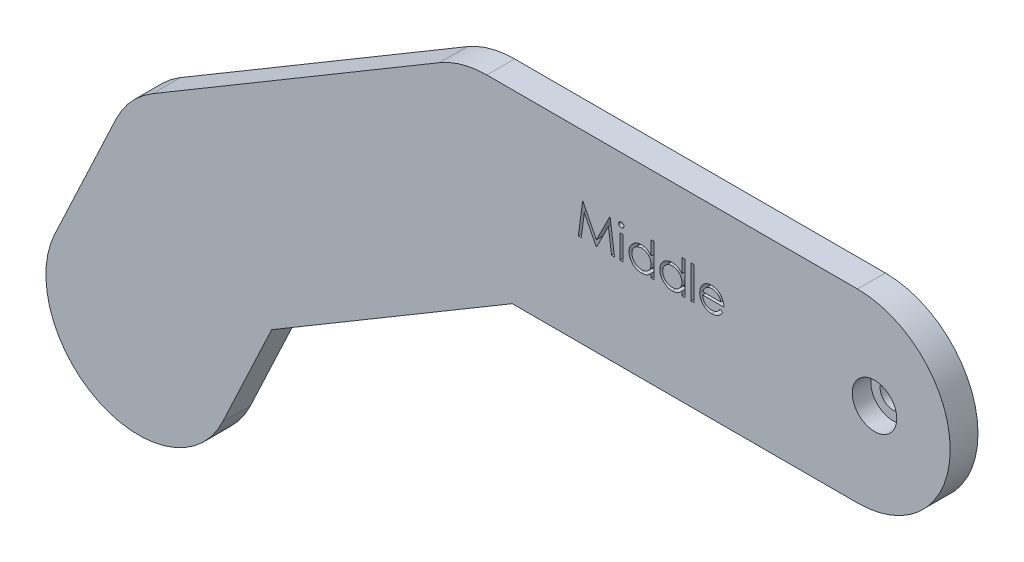
from build123d import *

# Parameters (mm, degrees)
BOSS_EXTRUDE1_DEPTH = 3
BOSS_EXTRUDE2_DEPTH = 3
BOSS_EXTRUDE4_DEPTH = 3
SKETCH4_R           = 1.4
CUT_EXTRUDE5_DEPTH  = 3
SKETCH5_R           = 2.4
CUT_EXTRUDE6_DEPTH  = 2
SKETCH7_W           = 0.314102564
SKETCH7_H           = 2.557692308
SKETCH7_H_2         = 3.58974359
CUT_EXTRUDE7_DEPTH  = 1


with BuildPart() as part:
    # Sketch1 → Boss-Extrude1 (new body)
    with BuildSketch(Plane.XY):
        with BuildLine():
            Line((0, 10), (40, 10))
            ThreePointArc((40, 10), (50, 0), (40, -10))
            Line((40, -10), (0, -10))
            ThreePointArc((0, -10), (-10, 0), (0, 10))
        make_face()
    extrude(amount=BOSS_EXTRUDE1_DEPTH)

    # Sketch2 → Boss-Extrude2 (add)
    with BuildSketch(Plane.XY):
        with BuildLine():
            Line((5.104260767, -8.599216361), (-25.852918132, -26.974555123))
            ThreePointArc((-25.852918132, -26.974555123), (-39.55639526, -23.479599529), (-36.061439666, -9.776122401))
            Line((-36.061439666, -9.776122401), (-5.104260767, 8.599216361))
            ThreePointArc((-5.104260767, 8.599216361), (8.599216361, 5.104260767), (5.104260767, -8.599216361))
        make_face()
    extrude(amount=BOSS_EXTRUDE2_DEPTH)

    # Sketch3 → Boss-Extrude4 (add)
    with BuildSketch(Plane.XY):
        with BuildLine():
            Line((-21.908567374, -22.63240694), (-28.526578438, -36.699320758))
            ThreePointArc((-28.526578438, -36.699320758), (-41.832258141, -41.490864104), (-46.623801487, -28.185184401))
            Line((-46.623801487, -28.185184401), (-40.005790424, -14.118270584))
            ThreePointArc((-40.005790424, -14.118270584), (-26.700110721, -9.326727237), (-21.908567374, -22.63240694))
        make_face()
    extrude(amount=BOSS_EXTRUDE4_DEPTH)

    # Sketch4 → Cut-Extrude5 (cut)
    with BuildSketch(Plane.XY):
        with Locations((41.835442891, 0)):
            Circle(SKETCH4_R)
    extrude(amount=CUT_EXTRUDE5_DEPTH, mode=Mode.SUBTRACT)

    # Sketch5 → Cut-Extrude6 (cut)
    with BuildSketch(Plane.XY.offset(3)):
        with Locations((41.835442891, 0)):
            Circle(SKETCH5_R)
    extrude(amount=-CUT_EXTRUDE6_DEPTH, mode=Mode.SUBTRACT)

    # Sketch7 → Cut-Extrude7 (cut)
    # profile 1 of 7: a face of its own
    with BuildSketch(Plane.XY.offset(3)):
        Polygon((9.870736081, -0.120306472), (10.332775344, 3.379693528), (10.377647139, 3.379693528), (11.822659158, 0.507898656), (13.264165569, 3.379693528), (13.309738485, 3.379693528), (13.774582235, -0.120306472), (13.459077428, -0.120306472), (13.12394121, 2.398123015), (11.860519735, -0.120306472), (11.789706434, -0.120306472), (10.521377107, 2.40373199), (10.186942011, -0.120306472), align=None)
    # profile 2 of 7: a face of its own
    with BuildSketch(Plane.XY.offset(3)):
        with BuildLine():
            add(Edge.make_bspline(
                [(14.513564607, 3.514308913), (14.533055923, 3.51340476), (14.571223663, 3.511634256), (14.62641693, 3.496472779), (14.676673942, 3.470773094), (14.721251675, 3.436293413), (14.759503562, 3.395743969), (14.786284272, 3.348483001), (14.803496668, 3.297424362), (14.805575224, 3.261809273), (14.806633517, 3.2436759)],
                knots=[0, 0, 0, 0, 1.055194115, 2.066272739, 3.074728998, 4.095836921, 5.109056067, 6.073838105, 7.019297344, 8, 8, 8, 8], degree=3))
            add(Edge.make_bspline(
                [(14.806633517, 3.2436759), (14.805551357, 3.226013247), (14.803412056, 3.191096272), (14.786297567, 3.1409228), (14.759275329, 3.094318516), (14.721276204, 3.053847806), (14.676667443, 3.019387186), (14.626418657, 2.993682447), (14.571223208, 2.97852231), (14.533055769, 2.976751621), (14.513564607, 2.975847374)],
                knots=[0, 0, 0, 0, 0.96129708, 1.900370562, 2.859976407, 3.87933698, 4.906634145, 5.921202961, 6.938410037, 8, 8, 8, 8], degree=3))
            add(Edge.make_bspline(
                [(14.513564607, 2.975847374), (14.494296332, 2.976717094), (14.456793152, 2.978409891), (14.402426309, 2.993979909), (14.35259782, 3.019395982), (14.307933147, 3.053622167), (14.270702954, 3.094567064), (14.243604629, 3.140894358), (14.226529667, 3.191103513), (14.224385038, 3.226015679), (14.223300184, 3.2436759)],
                knots=[0, 0, 0, 0, 1.054934014, 2.053291228, 3.073705704, 4.106921865, 5.123545215, 6.088680038, 7.033164197, 8, 8, 8, 8], degree=3))
            add(Edge.make_bspline(
                [(14.223300184, 3.2436759), (14.224361271, 3.26180675), (14.226445312, 3.297416882), (14.243617428, 3.348511915), (14.270477236, 3.395493417), (14.307957799, 3.436518916), (14.352591259, 3.470764351), (14.402428005, 3.496175333), (14.456792704, 3.511746672), (14.49429618, 3.513439286), (14.513564607, 3.514308913)],
                knots=[0, 0, 0, 0, 0.98631895, 1.937192651, 2.907499808, 3.917963147, 4.944918757, 5.95915025, 6.951458133, 8, 8, 8, 8], degree=3))
        make_face()
    # profile 3 of 7: a face of its own
    with BuildSketch(Plane.XY.offset(3)):
        with Locations((14.514966851, 1.158539682)):
            Rectangle(SKETCH7_W, SKETCH7_H)
    # profile 4 of 7: a face of its own
    with BuildSketch(Plane.XY.offset(3)):
        with BuildLine():
            Line((18.037402748, 3.469437118), (18.037402748, -0.120306472))
            Line((18.037402748, -0.120306472), (17.723300184, -0.120306472))
            Line((17.723300184, -0.120306472), (17.723300184, 0.322101381))
            add(Edge.make_bspline(
                [(17.723300184, 0.322101381), (17.687881393, 0.282061787), (17.618761178, 0.203924016), (17.50332006, 0.101841843), (17.380951882, 0.017463522), (17.252250561, -0.050686394), (17.117332318, -0.10187845), (16.97649623, -0.13826461), (16.82968485, -0.161658445), (16.729432495, -0.163994467), (16.67862871, -0.165178267)],
                knots=[0, 0, 0, 0, 1.074387032, 2.096679803, 3.090159297, 4.057316773, 5.018401886, 5.985159533, 6.978961417, 8, 8, 8, 8], degree=3))
            add(Edge.make_bspline(
                [(16.67862871, -0.165178267), (16.633460756, -0.163951894), (16.544387551, -0.161533434), (16.413358474, -0.14277113), (16.287266224, -0.112640509), (16.165991652, -0.070739619), (16.050319506, -0.015158798), (15.93925941, 0.05138245), (15.833386717, 0.13062328), (15.734315179, 0.221211309), (15.643083178, 0.319606296), (15.563021906, 0.424551843), (15.496268826, 0.535594147), (15.440448745, 0.651327301), (15.397452401, 0.77264222), (15.367478766, 0.899119388), (15.34873832, 1.030609262), (15.346320859, 1.120148785), (15.345095056, 1.1655509)],
                knots=[0, 0, 0, 0, 1.033919861, 2.038935746, 3.024066025, 3.998881131, 4.97069526, 5.957263378, 6.95902576, 7.993208707, 9.027059324, 10.027763471, 11.009749337, 11.988697705, 12.965288445, 13.950418724, 14.960734635, 16, 16, 16, 16], degree=3))
            add(Edge.make_bspline(
                [(15.345095056, 1.1655509), (15.346348027, 1.210014603), (15.348825084, 1.297916947), (15.367278304, 1.427195645), (15.398309312, 1.551713906), (15.44185716, 1.671070849), (15.497699115, 1.785410899), (15.565627202, 1.894814924), (15.645646327, 1.999584321), (15.737898734, 2.097255548), (15.837833504, 2.187476162), (15.944742235, 2.265885208), (16.055965516, 2.333602057), (16.173228527, 2.387255533), (16.294795632, 2.430664638), (16.421749077, 2.460697606), (16.553560656, 2.478394927), (16.643051148, 2.480957691), (16.688444415, 2.482257631)],
                knots=[0, 0, 0, 0, 1.020392517, 2.01726096, 2.990465484, 3.961182959, 4.928053699, 5.906110375, 6.912531644, 7.948652711, 8.985773172, 9.998621852, 10.987621588, 11.969261332, 12.953316658, 13.946091881, 14.958173133, 16, 16, 16, 16], degree=3))
            add(Edge.make_bspline(
                [(16.688444415, 2.482257631), (16.740661222, 2.480690535), (16.843157013, 2.477614499), (16.993055535, 2.451908132), (17.134843145, 2.408745254), (17.269336133, 2.349653973), (17.395732693, 2.272853222), (17.514959333, 2.180101774), (17.624942656, 2.068774628), (17.690014479, 1.985163054), (17.723300184, 1.942393849)],
                knots=[0, 0, 0, 0, 1.031072012, 2.023879775, 2.993683497, 3.952812103, 4.918022106, 5.908088563, 6.929940113, 8, 8, 8, 8], degree=3))
            Line((17.723300184, 1.942393849), (17.723300184, 3.469437118))
            Line((17.723300184, 3.469437118), (18.037402748, 3.469437118))
        make_face()
        with BuildLine():
            add(Edge.make_bspline(
                [(16.692651145, 2.168155067), (16.646736808, 2.166521429), (16.556109208, 2.163296888), (16.423065206, 2.138123393), (16.295751791, 2.096238798), (16.174805717, 2.038956897), (16.062137501, 1.96692816), (15.96144383, 1.879806777), (15.871901128, 1.779969763), (15.796592864, 1.667867653), (15.735202367, 1.547689562), (15.692035335, 1.422065123), (15.663566088, 1.293260146), (15.660657567, 1.20589746), (15.65919762, 1.162045291)],
                knots=[0, 0, 0, 0, 1.031046209, 2.035121221, 3.029706178, 4.034933723, 5.034054252, 6.02443088, 7.017295772, 8.038157696, 9.050218397, 10.03989886, 11.016116709, 12, 12, 12, 12], degree=3))
            add(Edge.make_bspline(
                [(15.65919762, 1.162045291), (15.661062513, 1.118455184), (15.66478499, 1.031445828), (15.691535684, 0.902465251), (15.736415558, 0.776811209), (15.797657621, 0.655550216), (15.874344245, 0.542966115), (15.963232898, 0.441225993), (16.065183179, 0.353736404), (16.178110686, 0.280498831), (16.298718657, 0.22133631), (16.425552588, 0.18017067), (16.556228226, 0.15359289), (16.64508056, 0.150488413), (16.689846658, 0.148924297)],
                knots=[0, 0, 0, 0, 0.979072187, 1.954306742, 2.945804271, 3.96968567, 4.997920485, 5.998718438, 6.996577872, 8.005894225, 9.015743152, 10.005417472, 10.995077863, 12, 12, 12, 12], degree=3))
            add(Edge.make_bspline(
                [(16.689846658, 0.148924297), (16.735293161, 0.150584261), (16.825681748, 0.153885765), (16.959120455, 0.17916703), (17.088615418, 0.220935829), (17.212402647, 0.278834955), (17.327718778, 0.350592311), (17.431216655, 0.434599402), (17.518732624, 0.532302586), (17.592925233, 0.639679039), (17.65110065, 0.757391036), (17.693476709, 0.882725227), (17.718530615, 1.015685975), (17.721688345, 1.106549902), (17.723300184, 1.152930708)],
                knots=[0, 0, 0, 0, 1.01762866, 2.023962475, 3.030623092, 4.058876274, 5.077231937, 6.066672613, 7.034107872, 8.005628644, 8.981990164, 9.965428785, 10.961468474, 12, 12, 12, 12], degree=3))
            add(Edge.make_bspline(
                [(17.723300184, 1.152930708), (17.722340528, 1.188268538), (17.72045162, 1.257824571), (17.706021051, 1.359952089), (17.683066124, 1.457685815), (17.650719954, 1.551128504), (17.60822867, 1.63976352), (17.556980904, 1.72422728), (17.496075454, 1.804080491), (17.426492758, 1.878223562), (17.350327556, 1.945850024), (17.269733015, 2.006214265), (17.183754268, 2.055803038), (17.093837231, 2.096844309), (16.999825897, 2.129503459), (16.900955277, 2.151291153), (16.79827629, 2.166251474), (16.728230234, 2.167513855), (16.692651145, 2.168155067)],
                knots=[0, 0, 0, 0, 1.050140795, 2.067009409, 3.05949893, 4.030605086, 5.00011959, 5.97591094, 6.962425594, 7.979863591, 8.993523472, 9.986985069, 10.967611495, 11.937549037, 12.921786183, 13.919465291, 14.943216303, 16, 16, 16, 16], degree=3))
        make_face(mode=Mode.SUBTRACT)
    # profile 5 of 7: a face of its own
    with BuildSketch(Plane.XY.offset(3)):
        with BuildLine():
            Line((21.357915569, 3.469437118), (21.357915569, -0.120306472))
            Line((21.357915569, -0.120306472), (21.043813004, -0.120306472))
            Line((21.043813004, -0.120306472), (21.043813004, 0.322101381))
            add(Edge.make_bspline(
                [(21.043813004, 0.322101381), (21.008394214, 0.282061787), (20.939273999, 0.203924016), (20.823832881, 0.101841843), (20.701464703, 0.017463522), (20.572763382, -0.050686394), (20.437845138, -0.10187845), (20.297009051, -0.13826461), (20.15019767, -0.161658445), (20.049945315, -0.163994467), (19.99914153, -0.165178267)],
                knots=[0, 0, 0, 0, 1.074387032, 2.096679803, 3.090159297, 4.057316773, 5.018401886, 5.985159533, 6.978961417, 8, 8, 8, 8], degree=3))
            add(Edge.make_bspline(
                [(19.99914153, -0.165178267), (19.953973576, -0.163951894), (19.864900371, -0.161533434), (19.733871294, -0.14277113), (19.607779045, -0.112640509), (19.486504472, -0.070739619), (19.370832327, -0.015158798), (19.25977223, 0.05138245), (19.153899538, 0.13062328), (19.054827999, 0.221211309), (18.963595999, 0.319606296), (18.883534726, 0.424551843), (18.816781646, 0.535594147), (18.760961565, 0.651327301), (18.717965221, 0.77264222), (18.687991587, 0.899119388), (18.66925114, 1.030609262), (18.666833679, 1.120148785), (18.665607876, 1.1655509)],
                knots=[0, 0, 0, 0, 1.033919861, 2.038935746, 3.024066025, 3.998881131, 4.97069526, 5.957263378, 6.95902576, 7.993208707, 9.027059324, 10.027763471, 11.009749337, 11.988697705, 12.965288445, 13.950418724, 14.960734635, 16, 16, 16, 16], degree=3))
            add(Edge.make_bspline(
                [(18.665607876, 1.1655509), (18.666860848, 1.210014603), (18.669337904, 1.297916947), (18.687791124, 1.427195645), (18.718822133, 1.551713906), (18.762369981, 1.671070849), (18.818211936, 1.785410899), (18.886140023, 1.894814924), (18.966159147, 1.999584321), (19.058411554, 2.097255548), (19.158346325, 2.187476162), (19.265255055, 2.265885208), (19.376478337, 2.333602057), (19.493741347, 2.387255533), (19.615308452, 2.430664638), (19.742261898, 2.460697606), (19.874073477, 2.478394927), (19.963563969, 2.480957691), (20.008957235, 2.482257631)],
                knots=[0, 0, 0, 0, 1.020392517, 2.01726096, 2.990465484, 3.961182959, 4.928053699, 5.906110375, 6.912531644, 7.948652711, 8.985773172, 9.998621852, 10.987621588, 11.969261332, 12.953316658, 13.946091881, 14.958173133, 16, 16, 16, 16], degree=3))
            add(Edge.make_bspline(
                [(20.008957235, 2.482257631), (20.061174043, 2.480690535), (20.163669834, 2.477614499), (20.313568355, 2.451908132), (20.455355966, 2.408745254), (20.589848953, 2.349653973), (20.716245513, 2.272853222), (20.835472154, 2.180101774), (20.945455477, 2.068774628), (21.010527299, 1.985163054), (21.043813004, 1.942393849)],
                knots=[0, 0, 0, 0, 1.031072012, 2.023879775, 2.993683497, 3.952812103, 4.918022106, 5.908088563, 6.929940113, 8, 8, 8, 8], degree=3))
            Line((21.043813004, 1.942393849), (21.043813004, 3.469437118))
            Line((21.043813004, 3.469437118), (21.357915569, 3.469437118))
        make_face()
        with BuildLine():
            add(Edge.make_bspline(
                [(20.013163966, 2.168155067), (19.967249628, 2.166521429), (19.876622028, 2.163296888), (19.743578026, 2.138123393), (19.616264612, 2.096238798), (19.495318538, 2.038956897), (19.382650321, 1.96692816), (19.28195665, 1.879806777), (19.192413949, 1.779969763), (19.117105685, 1.667867653), (19.055715188, 1.547689562), (19.012548156, 1.422065123), (18.984078908, 1.293260146), (18.981170388, 1.20589746), (18.97971044, 1.162045291)],
                knots=[0, 0, 0, 0, 1.031046209, 2.035121221, 3.029706178, 4.034933723, 5.034054252, 6.02443088, 7.017295772, 8.038157696, 9.050218397, 10.03989886, 11.016116709, 12, 12, 12, 12], degree=3))
            add(Edge.make_bspline(
                [(18.97971044, 1.162045291), (18.981575334, 1.118455184), (18.985297811, 1.031445828), (19.012048505, 0.902465251), (19.056928378, 0.776811209), (19.118170441, 0.655550216), (19.194857066, 0.542966115), (19.283745718, 0.441225993), (19.385696, 0.353736404), (19.498623507, 0.280498831), (19.619231477, 0.22133631), (19.746065409, 0.18017067), (19.876741047, 0.15359289), (19.965593381, 0.150488413), (20.010359479, 0.148924297)],
                knots=[0, 0, 0, 0, 0.979072187, 1.954306742, 2.945804271, 3.96968567, 4.997920485, 5.998718438, 6.996577872, 8.005894225, 9.015743152, 10.005417472, 10.995077863, 12, 12, 12, 12], degree=3))
            add(Edge.make_bspline(
                [(20.010359479, 0.148924297), (20.055805982, 0.150584261), (20.146194568, 0.153885765), (20.279633276, 0.17916703), (20.409128239, 0.220935829), (20.532915467, 0.278834955), (20.648231598, 0.350592311), (20.751729476, 0.434599402), (20.839245444, 0.532302586), (20.913438054, 0.639679039), (20.971613471, 0.757391036), (21.01398953, 0.882725227), (21.039043436, 1.015685975), (21.042201165, 1.106549902), (21.043813004, 1.152930708)],
                knots=[0, 0, 0, 0, 1.01762866, 2.023962475, 3.030623092, 4.058876274, 5.077231937, 6.066672613, 7.034107872, 8.005628644, 8.981990164, 9.965428785, 10.961468474, 12, 12, 12, 12], degree=3))
            add(Edge.make_bspline(
                [(21.043813004, 1.152930708), (21.042853348, 1.188268538), (21.040964441, 1.257824571), (21.026533871, 1.359952089), (21.003578945, 1.457685815), (20.971232775, 1.551128504), (20.92874149, 1.63976352), (20.877493724, 1.72422728), (20.816588275, 1.804080491), (20.747005579, 1.878223562), (20.670840376, 1.945850024), (20.590245835, 2.006214265), (20.504267088, 2.055803038), (20.414350052, 2.096844309), (20.320338717, 2.129503459), (20.221468097, 2.151291153), (20.11878911, 2.166251474), (20.048743055, 2.167513855), (20.013163966, 2.168155067)],
                knots=[0, 0, 0, 0, 1.050140795, 2.067009409, 3.05949893, 4.030605086, 5.00011959, 5.97591094, 6.962425594, 7.979863591, 8.993523472, 9.986985069, 10.967611495, 11.937549037, 12.921786183, 13.919465291, 14.943216303, 16, 16, 16, 16], degree=3))
        make_face(mode=Mode.SUBTRACT)
    # profile 6 of 7: a face of its own
    with BuildSketch(Plane.XY.offset(3)):
        with Locations((22.188043774, 1.674565323)):
            Rectangle(SKETCH7_W, SKETCH7_H_2)
    # profile 7 of 7: a face of its own
    with BuildSketch(Plane.XY.offset(3)):
        with BuildLine():
            Line((25.162202428, 0.687385836), (25.441248902, 0.540851381))
            add(Edge.make_bspline(
                [(25.441248902, 0.540851381), (25.419012307, 0.501408049), (25.375748698, 0.424666947), (25.30134795, 0.319235086), (25.223355878, 0.22438737), (25.13825191, 0.142657716), (25.048582231, 0.071406331), (24.953849576, 0.009068506), (24.853560758, -0.044050014), (24.747711033, -0.088802542), (24.635411482, -0.123212036), (24.516389966, -0.147516257), (24.390418471, -0.162539526), (24.304072291, -0.164284666), (24.259858678, -0.165178267)],
                knots=[0, 0, 0, 0, 1.120438281, 2.179929193, 3.190490725, 4.156257408, 5.095198341, 6.022838206, 6.959905092, 7.901321166, 8.864066838, 9.862729781, 10.905609505, 12, 12, 12, 12], degree=3))
            add(Edge.make_bspline(
                [(24.259858678, -0.165178267), (24.2107167, -0.164031091), (24.114854938, -0.161793285), (23.975315191, -0.14250082), (23.843935773, -0.111028462), (23.720724069, -0.06706292), (23.605981817, -0.009635596), (23.499480962, 0.060323886), (23.400661436, 0.142456141), (23.312637227, 0.237472584), (23.233393344, 0.339154541), (23.163467524, 0.445110426), (23.105010093, 0.55507365), (23.057457483, 0.668344174), (23.019052618, 0.784208068), (22.992285914, 0.903719535), (22.976856166, 1.02655512), (22.974491721, 1.109652455), (22.973300184, 1.151528464)],
                knots=[0, 0, 0, 0, 1.145258523, 2.234067595, 3.276747158, 4.290159414, 5.277019952, 6.260822364, 7.254936242, 8.264827045, 9.274100331, 10.257902744, 11.220704747, 12.172965371, 13.118907548, 14.062713208, 15.023725156, 16, 16, 16, 16], degree=3))
            add(Edge.make_bspline(
                [(22.973300184, 1.151528464), (22.974359325, 1.190823294), (22.976458404, 1.268700459), (22.989689191, 1.383966004), (23.013137484, 1.495994456), (23.045313808, 1.604878904), (23.086865054, 1.710437038), (23.137697273, 1.812733102), (23.197889651, 1.911658242), (23.244362325, 1.974061375), (23.267771338, 2.00549481)],
                knots=[0, 0, 0, 0, 1.024358464, 2.0301432, 3.019427413, 4.004406732, 4.986367066, 5.972626655, 6.978780325, 8, 8, 8, 8], degree=3))
            add(Edge.make_bspline(
                [(23.267771338, 2.00549481), (23.299479021, 2.04336368), (23.361889967, 2.117901831), (23.467446323, 2.215840156), (23.581746519, 2.297883932), (23.703358145, 2.365891068), (23.833694619, 2.417564715), (23.97100391, 2.456072297), (24.116849496, 2.477650308), (24.216554717, 2.480698142), (24.267571017, 2.482257631)],
                knots=[0, 0, 0, 0, 1.030682036, 2.02871468, 2.997146059, 3.962720338, 4.930598197, 5.918074684, 6.934738563, 8, 8, 8, 8], degree=3))
            add(Edge.make_bspline(
                [(24.267571017, 2.482257631), (24.320018623, 2.480903582), (24.422908869, 2.478247247), (24.57294099, 2.453620913), (24.714901706, 2.414568359), (24.84873421, 2.359414568), (24.974452071, 2.288255016), (25.091238121, 2.200113175), (25.201089633, 2.097695088), (25.264998212, 2.018931878), (25.297518934, 1.978852182)],
                knots=[0, 0, 0, 0, 1.056321875, 2.072262726, 3.055038591, 4.01806755, 4.982017516, 5.957941055, 6.960871419, 8, 8, 8, 8], degree=3))
            add(Edge.make_bspline(
                [(25.297518934, 1.978852182), (25.319645872, 1.948648601), (25.363752465, 1.888442482), (25.418999565, 1.790271325), (25.46695696, 1.68756073), (25.505289921, 1.578650433), (25.536329423, 1.464830853), (25.558786241, 1.345288308), (25.57195586, 1.220058397), (25.574544557, 1.134731842), (25.575864287, 1.09123199)],
                knots=[0, 0, 0, 0, 0.94817472, 1.890038105, 2.849395472, 3.817997239, 4.812318967, 5.836947057, 6.897266129, 8, 8, 8, 8], degree=3))
            Line((25.575864287, 1.09123199), (23.287402748, 1.09123199))
            add(Edge.make_bspline(
                [(23.287402748, 1.09123199), (23.288942354, 1.057531525), (23.291969928, 0.991260922), (23.306085072, 0.894290139), (23.328333845, 0.801916796), (23.359602908, 0.714833754), (23.397469753, 0.631903627), (23.44385547, 0.55374159), (23.499195024, 0.48070366), (23.560920723, 0.412136522), (23.629627819, 0.351075761), (23.701910566, 0.296423985), (23.778804131, 0.250618388), (23.859702214, 0.213438498), (23.944474, 0.184332182), (24.033146195, 0.164464362), (24.125544311, 0.151157255), (24.188530045, 0.14967759), (24.220595857, 0.148924297)],
                knots=[0, 0, 0, 0, 1.094153842, 2.151609401, 3.174256925, 4.172055639, 5.149267565, 6.128595816, 7.11444997, 8.118368179, 9.117203808, 10.09244225, 11.054858984, 12.015122123, 12.976791628, 13.957293641, 14.960065497, 16, 16, 16, 16], degree=3))
            add(Edge.make_bspline(
                [(24.220595857, 0.148924297), (24.251947005, 0.149532354), (24.314153696, 0.150738855), (24.406794553, 0.162470766), (24.49793408, 0.181441042), (24.587195064, 0.207331032), (24.672765909, 0.238907884), (24.75201146, 0.277010741), (24.824891675, 0.319160488), (24.893008642, 0.367370163), (24.959079635, 0.42637835), (25.024622122, 0.500014071), (25.094898775, 0.587101599), (25.138888368, 0.652647265), (25.162202428, 0.687385836)],
                knots=[0, 0, 0, 0, 0.99110716, 1.966546729, 2.947904876, 3.932708344, 4.903319531, 5.828989031, 6.710028674, 7.56322171, 8.463672341, 9.504779593, 10.677557249, 12, 12, 12, 12], degree=3))
        make_face()
        with BuildLine():
            add(Edge.make_bspline(
                [(25.261761722, 1.405334554), (25.250265098, 1.446997427), (25.228137796, 1.527185048), (25.181901432, 1.638225939), (25.129829891, 1.73691384), (25.06820816, 1.822493473), (24.998389434, 1.898496986), (24.917744252, 1.964915571), (24.827308358, 2.024333022), (24.727549217, 2.074485521), (24.621907432, 2.11717538), (24.51130124, 2.145800496), (24.398443452, 2.165410038), (24.322109166, 2.167236146), (24.283696819, 2.168155067)],
                knots=[0, 0, 0, 0, 1.154881502, 2.222775134, 3.210006277, 4.132804581, 5.035138423, 5.962687519, 6.919655026, 7.923214229, 8.944639381, 9.960483929, 10.97369054, 12, 12, 12, 12], degree=3))
            add(Edge.make_bspline(
                [(24.283696819, 2.168155067), (24.25234738, 2.167543395), (24.190376131, 2.166334249), (24.099075063, 2.15486412), (24.011395364, 2.135904275), (23.926690076, 2.109939318), (23.846069208, 2.075330716), (23.76787444, 2.034747489), (23.694094043, 1.985205905), (23.647952748, 1.94744705), (23.624642331, 1.928371413)],
                knots=[0, 0, 0, 0, 1.04873581, 2.073130211, 3.073294108, 4.04793562, 5.032784715, 6.005352987, 6.992311501, 8, 8, 8, 8], degree=3))
            add(Edge.make_bspline(
                [(23.624642331, 1.928371413), (23.607949049, 1.913277097), (23.574165915, 1.882729881), (23.529025394, 1.830100675), (23.485804921, 1.773349112), (23.446471268, 1.710303988), (23.410393682, 1.641683209), (23.376633705, 1.568065574), (23.346247293, 1.488892443), (23.329151183, 1.433720004), (23.320355472, 1.405334554)],
                knots=[0, 0, 0, 0, 0.879870761, 1.780643979, 2.707998968, 3.669668524, 4.684282772, 5.740141944, 6.837334558, 8, 8, 8, 8], degree=3))
            Line((23.320355472, 1.405334554), (25.261761722, 1.405334554))
        make_face(mode=Mode.SUBTRACT)
    extrude(amount=-CUT_EXTRUDE7_DEPTH, mode=Mode.SUBTRACT)


solid = part.part
